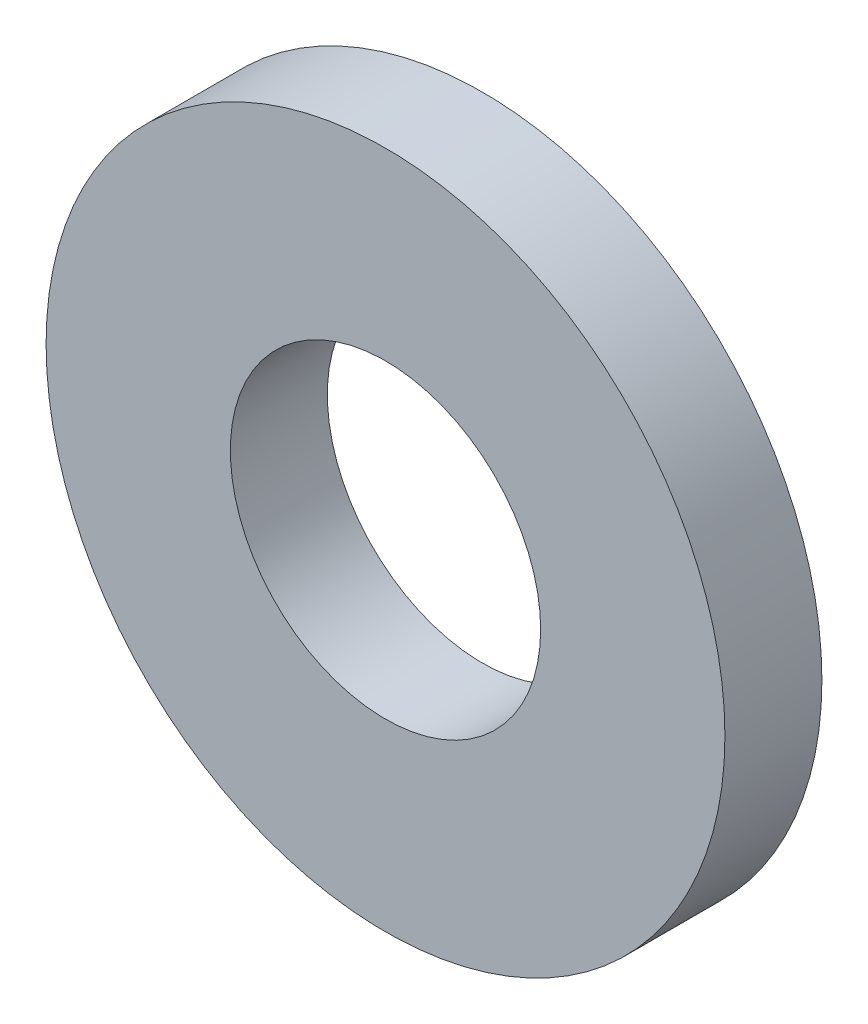
from build123d import *

# Parameters (mm, degrees)
SKETCH_251_R    = 3.5
SKETCH_251_R_2  = 1.6
EXTRUDE_1_DEPTH = 1


with BuildPart() as part:
    # Sketch 251 → 拉伸1 (new body)
    with BuildSketch(Plane.XY):
        Circle(SKETCH_251_R)
        Circle(SKETCH_251_R_2, mode=Mode.SUBTRACT)
    extrude(amount=EXTRUDE_1_DEPTH)


solid = part.part
